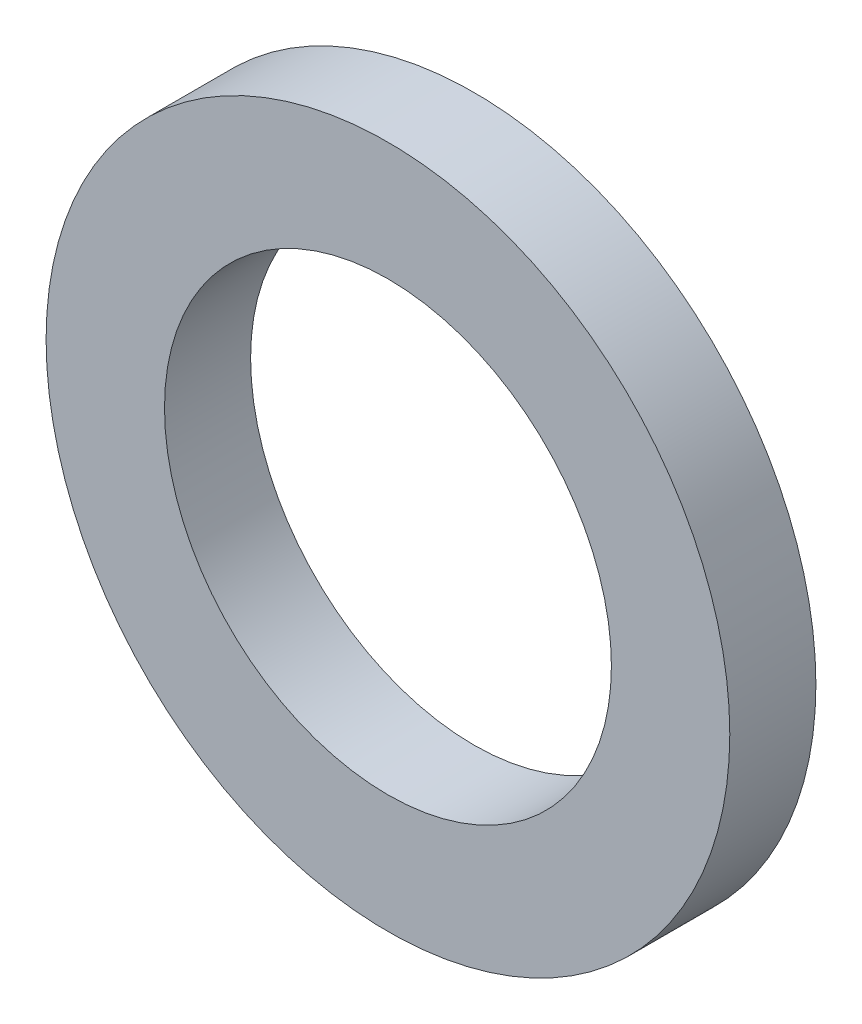
from build123d import *

# Parameters (mm, degrees)
SZKIC1_R                    = 7.94
SZKIC1_R_2                  = 5.19
DODANIE_WYCI_GNI_CIE2_DEPTH = 2


with BuildPart() as part:
    # Szkic1 → Dodanie-wyciągnięcie2 (new body)
    with BuildSketch(Plane.XY):
        Circle(SZKIC1_R)
        Circle(SZKIC1_R_2, mode=Mode.SUBTRACT)
    extrude(amount=DODANIE_WYCI_GNI_CIE2_DEPTH)


solid = part.part
